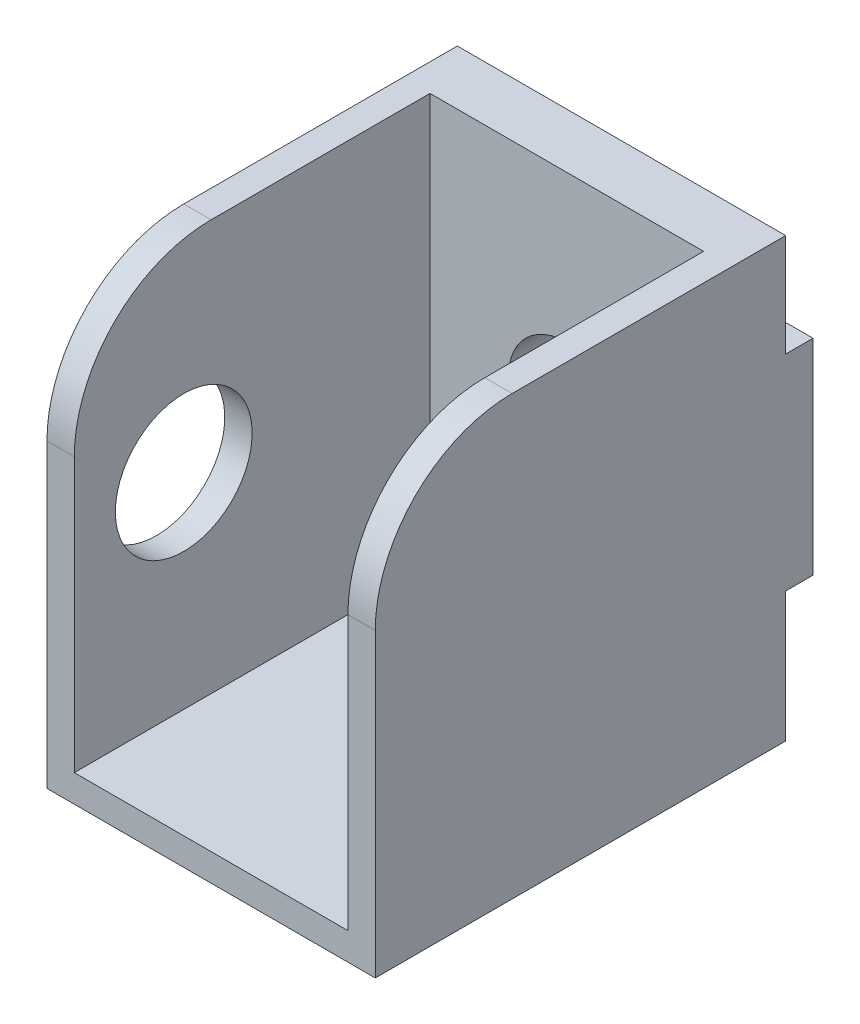
from build123d import *

# Parameters (mm, degrees)
SKETCH1_W           = 20
SKETCH1_H           = 30
SKETCH1_R           = 4.25
BOSS_EXTRUDE1_DEPTH = 4
SKETCH2_W           = 20
SKETCH2_H           = 30
BOSS_EXTRUDE2_DEPTH = 2
SKETCH4_R           = 5
BOSS_EXTRUDE3_DEPTH = 2
BOSS_EXTRUDE4_START = 2
BOSS_EXTRUDE4_DEPTH = 2
SKETCH6_W           = 2
SKETCH6_H           = 15
BOSS_EXTRUDE5_DEPTH = 2


with BuildPart() as part:
    # Sketch1 → Boss-Extrude1 (new body)
    with BuildSketch(Plane.XY):
        Rectangle(SKETCH1_W, SKETCH1_H)
        Circle(SKETCH1_R, mode=Mode.SUBTRACT)
    extrude(amount=BOSS_EXTRUDE1_DEPTH)

    # Sketch2 → Boss-Extrude2 (add)
    with BuildSketch(Plane(origin=(0, -15, 0), x_dir=(-1, 0, 0), z_dir=(0, -1, 0))):
        with Locations((0, -15)):
            Rectangle(SKETCH2_W, SKETCH2_H)
    extrude(amount=BOSS_EXTRUDE2_DEPTH)

    # Sketch4 → Boss-Extrude3 (add)
    with BuildSketch(Plane.ZY.offset(10)):
        with BuildLine():
            Line((0, 15), (20, 15))
            ThreePointArc((20, 15), (27.071067812, 12.071067812), (30, 5))
            Line((30, 5), (30, -17))
            Line((30, -17), (0, -17))
            Line((0, -17), (0, 15))
        make_face()
        with Locations((22, 0)):
            Circle(SKETCH4_R, mode=Mode.SUBTRACT)
    extrude(amount=BOSS_EXTRUDE3_DEPTH)

    # Sketch5 → Boss-Extrude4 (add)
    with BuildSketch(Plane(origin=(10, 0, 0), x_dir=(0, 0, -1), z_dir=(1, 0, 0)).offset(BOSS_EXTRUDE4_START)):
        with BuildLine():
            Line((0, 15), (-20, 15))
            ThreePointArc((-20, 15), (-27.071067812, 12.071067812), (-30, 5))
            Line((-30, 5), (-30, -17))
            Line((-30, -17), (0, -17))
            Line((0, -17), (0, 15))
        make_face()
    extrude(amount=-BOSS_EXTRUDE4_DEPTH)

    # Sketch6 → Boss-Extrude5 (add)
    with BuildSketch(Plane(origin=(0, 0, 0), x_dir=(-1, 0, 0), z_dir=(0, 0, -1))):
        with Locations((-11, 0)):
            Rectangle(SKETCH6_W, SKETCH6_H)
        with Locations((11, 0)):
            Rectangle(SKETCH6_W, SKETCH6_H)
    extrude(amount=BOSS_EXTRUDE5_DEPTH)


solid = part.part
